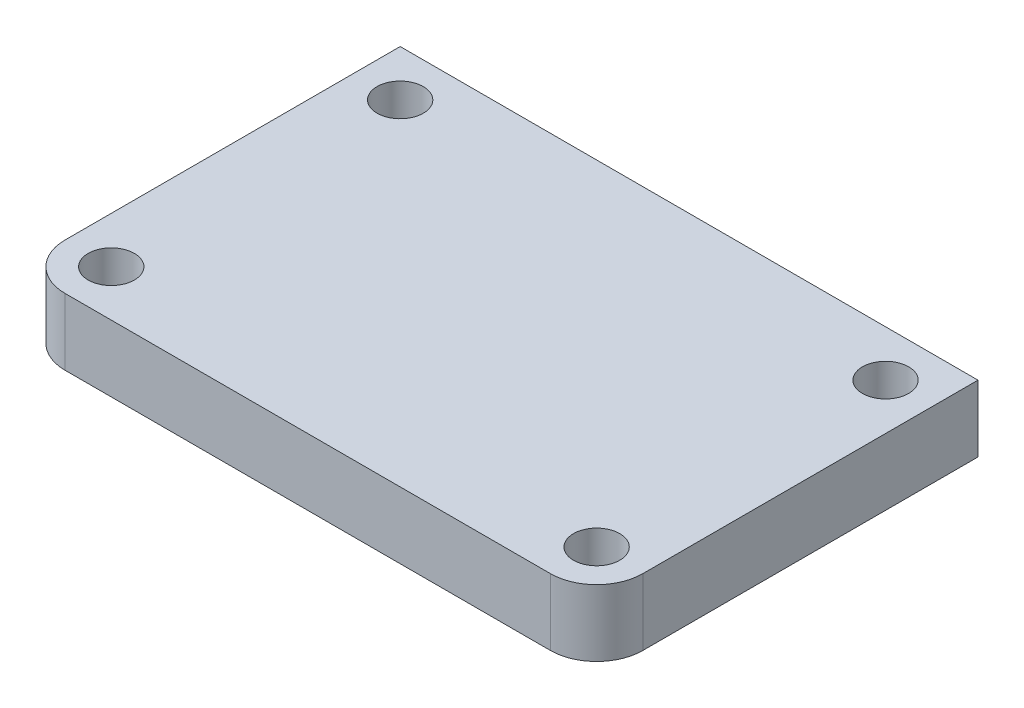
from build123d import *

# Parameters (mm, degrees)
SKETCH1_W           = 25
SKETCH1_H           = 16.5
BOSS_EXTRUDE1_DEPTH = 2.88
SKETCH2_R           = 1
CUT_EXTRUDE1_DEPTH  = 18.565431962
FILLET1_R           = 2


with BuildPart() as part:
    # Sketch1 → Boss-Extrude1 (new body)
    with BuildSketch(Plane(origin=(0, 0, 0), x_dir=(1, 0, 0), z_dir=(0, 1, 0))):
        with Locations((0, -3.75)):
            Rectangle(SKETCH1_W, SKETCH1_H)
    extrude(amount=BOSS_EXTRUDE1_DEPTH)

    # Sketch2 → Cut-Extrude1 (cut, through all)
    with BuildSketch(Plane(origin=(0, 2.88, 0), x_dir=(1, 0, 0), z_dir=(0, 1, 0))):
        with Locations(Location((-10.5, 2.5, 0), (0, 0, 270))):
            Circle(SKETCH2_R)
        with Locations(Location((-10.5, -10, 0), (0, 0, 270))):
            Circle(SKETCH2_R)
        with Locations(Location((10.5, -10, 0), (0, 0, 270))):
            Circle(SKETCH2_R)
        with Locations(Location((10.5, 2.5, 0), (0, 0, 270))):
            Circle(SKETCH2_R)
    extrude(amount=-CUT_EXTRUDE1_DEPTH, mode=Mode.SUBTRACT)

    # Fillet1
    fillet1_edges = [part.edges().sort_by_distance(p)[0] for p in [
        (12.5, 1.44, 12),
        (-12.5, 1.44, 12),
    ]]
    fillet(fillet1_edges, radius=FILLET1_R)


solid = part.part
